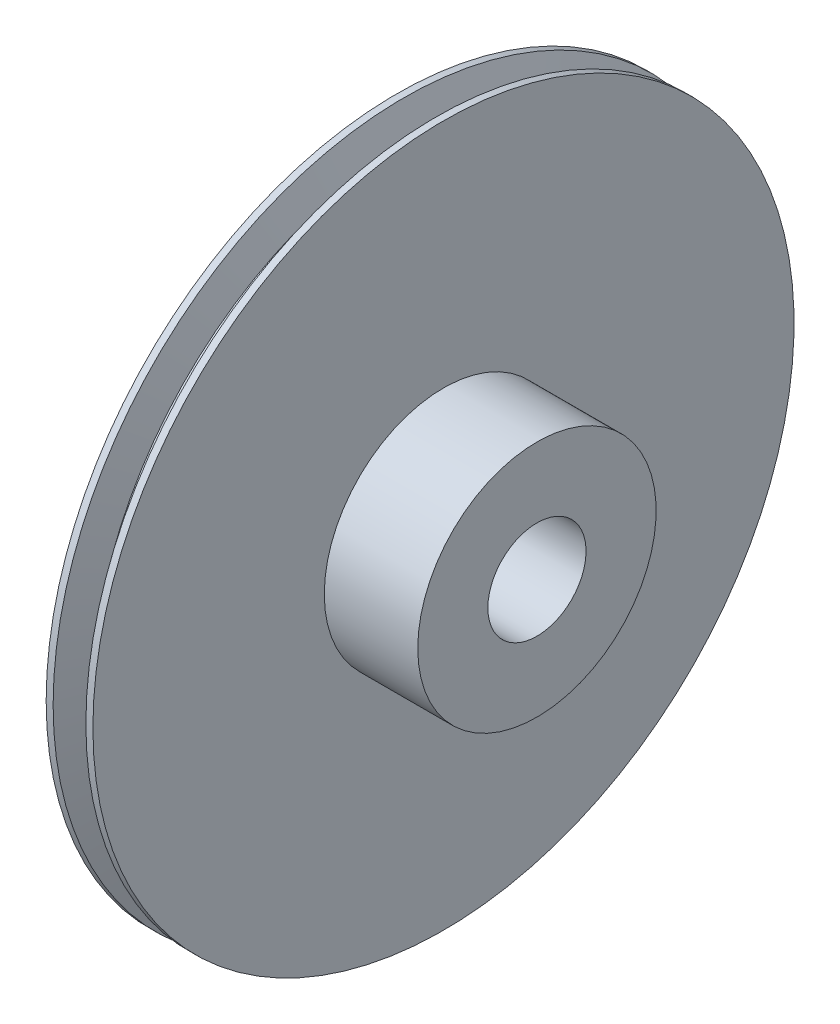
from build123d import *


with BuildPart() as part:
    # Sketch1 → Revolve1 (revolve)
    with BuildSketch(Plane.XY, mode=Mode.PRIVATE) as revolve1_sk:
        Polygon((0, 10.5), (0, 75), (1.489484489, 75), (3.81973562, 68.927197178), (6.18026438, 68.927197178), (8.495965845, 75), (10, 75), (10, 25.5), (30, 25.5), (30, 10.5), align=None)
    revolve(revolve1_sk.sketch.rotate(Axis((0, 0, 0), (1, 0, 0)), 90), axis=Axis((0, 0, 0), (1, 0, 0)))


solid = part.part
